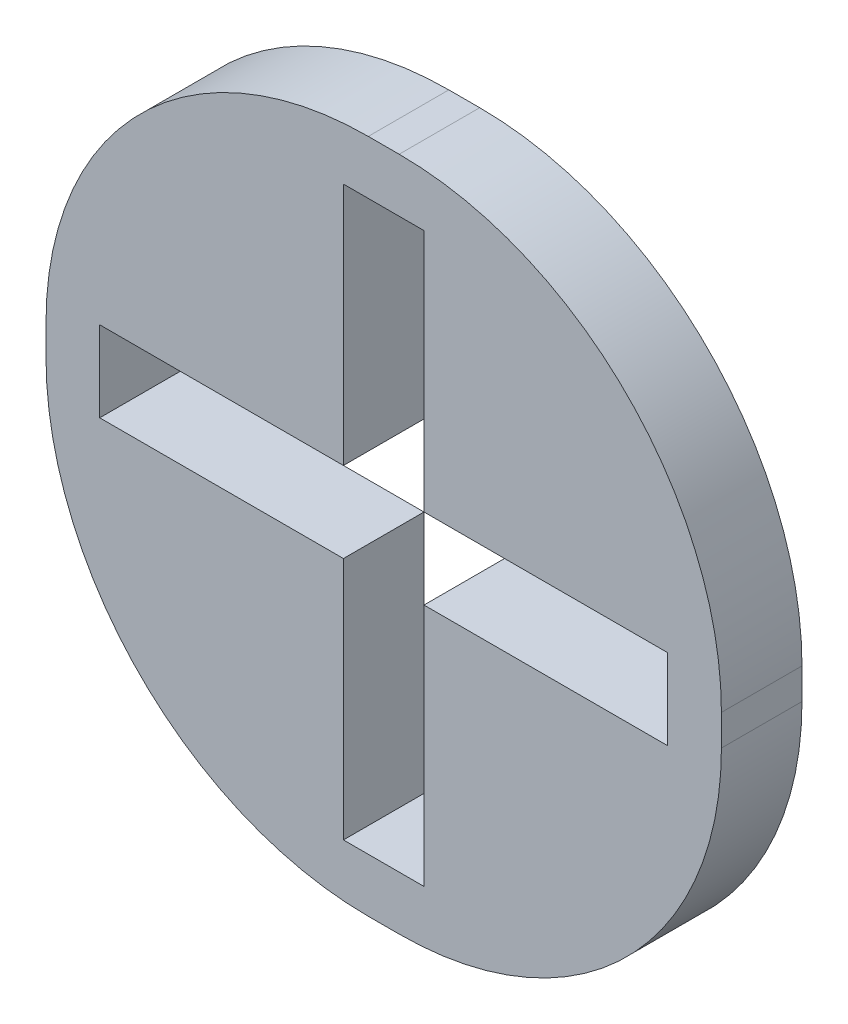
from build123d import *

# Parameters (mm, degrees)
SALIENTE_EXTRUIR1_DEPTH = 3


with BuildPart() as part:
    # Croquis1 → Saliente-Extruir1 (new body)
    with BuildSketch(Plane.XY):
        with BuildLine():
            Line((-0.575, -12.575), (0.575, -12.575))
            ThreePointArc((0.575, -12.575), (9.060281374, -9.060281374), (12.575, -0.575))
            Line((12.575, -0.575), (12.575, 0.575))
            ThreePointArc((12.575, 0.575), (9.060281374, 9.060281374), (0.575, 12.575))
            Line((0.575, 12.575), (-0.575, 12.575))
            ThreePointArc((-0.575, 12.575), (-9.060281374, 9.060281374), (-12.575, 0.575))
            Line((-12.575, 0.575), (-12.575, -0.575))
            ThreePointArc((-12.575, -0.575), (-9.060281374, -9.060281374), (-0.575, -12.575))
        make_face()
        Polygon((-10.575, -1.5), (-10.575, 1.5), (-1.5, 1.5), (-1.5, 10.575), (1.5, 10.575), (1.5, 1.5), (10.575, 1.5), (10.575, -1.5), (1.5, -1.5), (1.5, -10.575), (-1.5, -10.575), (-1.5, -1.5), align=None, mode=Mode.SUBTRACT)
    extrude(amount=SALIENTE_EXTRUIR1_DEPTH)


solid = part.part
